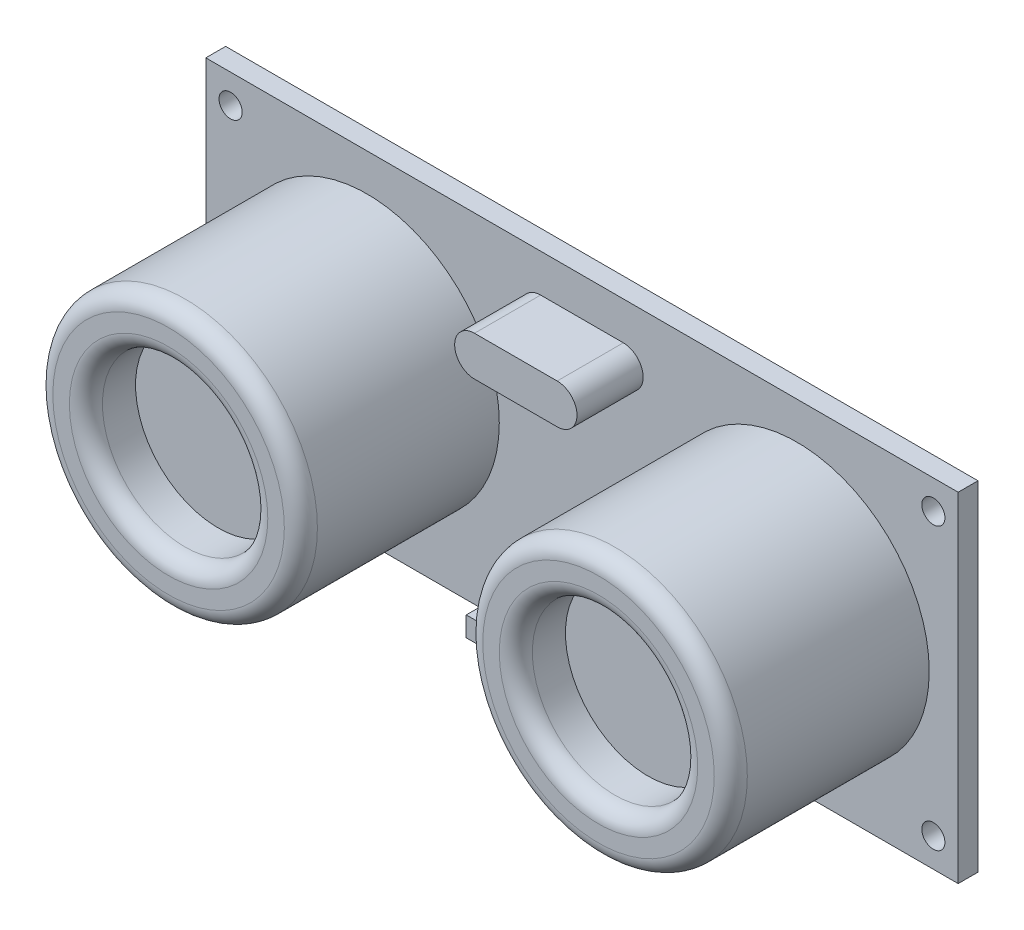
from build123d import *

# Parameters (mm, degrees)
SKETCH_1_W          = 45.5
SKETCH_1_H          = 20.5
SKETCH_1_R          = 0.7
EXTRUDE_1_DEPTH     = 1.2
SKETCH_2_R          = 8
EXTRUDE_2_DEPTH     = 12
SKETCH_3_R          = 5
CUT_EXTRUDE_1_DEPTH = 3
FILLET_1_R          = 1
EXTRUDE_3_DEPTH     = 4
SKETCH_5_W          = 8
SKETCH_5_H          = 1.2
EXTRUDE_4_DEPTH     = 3


with BuildPart() as part:
    # 草图1 → 凸台-拉伸1 (new body)
    with BuildSketch(Plane.XY):
        Rectangle(SKETCH_1_W, SKETCH_1_H)
        with Locations((21.25, 8.5)):
            Circle(SKETCH_1_R, mode=Mode.SUBTRACT)
        with Locations((-21.25, 8.5)):
            Circle(SKETCH_1_R, mode=Mode.SUBTRACT)
        with Locations((-21.25, -8.5)):
            Circle(SKETCH_1_R, mode=Mode.SUBTRACT)
        with Locations((21.25, -8.5)):
            Circle(SKETCH_1_R, mode=Mode.SUBTRACT)
    extrude(amount=EXTRUDE_1_DEPTH)

    # 草图2 → 凸台-拉伸2 (add)
    with BuildSketch(Plane.XY.offset(1.2)):
        with Locations(Location((-13, 0, 0), (0, 0, 180))):
            Circle(SKETCH_2_R)
        with Locations(Location((13, 0, 0), (0, 0, 180))):
            Circle(SKETCH_2_R)
    extrude(amount=EXTRUDE_2_DEPTH)

    # 草图3 → 切除-拉伸1 (cut)
    with BuildSketch(Plane.XY.offset(13.2)):
        with Locations((-13, 0)):
            Circle(SKETCH_3_R)
        with Locations((13, 0)):
            Circle(SKETCH_3_R)
    extrude(amount=-CUT_EXTRUDE_1_DEPTH, mode=Mode.SUBTRACT)

    # 圆角1
    fillet_1_edges = [part.edges().sort_by_distance(p)[0] for p in [
        (-5, 0, 13.2),
        (21, 0, 13.2),
        (-18, 0, 13.2),
        (8, 0, 13.2),
    ]]
    fillet(fillet_1_edges, radius=FILLET_1_R)

    # 草图4 → 凸台-拉伸3 (add)
    with BuildSketch(Plane.XY.offset(1.2)):
        with BuildLine():
            Line((-2.5, 7.95), (2.5, 7.95))
            ThreePointArc((2.5, 7.95), (3.7, 6.75), (2.5, 5.55))
            Line((2.5, 5.55), (-2.5, 5.55))
            ThreePointArc((-2.5, 5.55), (-3.7, 6.75), (-2.5, 7.95))
        make_face()
    extrude(amount=EXTRUDE_3_DEPTH)

    # 草图5 → 凸台-拉伸4 (add)
    with BuildSketch(Plane.XY.offset(1.2)):
        with Locations((0, -8.65)):
            Rectangle(SKETCH_5_W, SKETCH_5_H)
    extrude(amount=EXTRUDE_4_DEPTH)


solid = part.part
